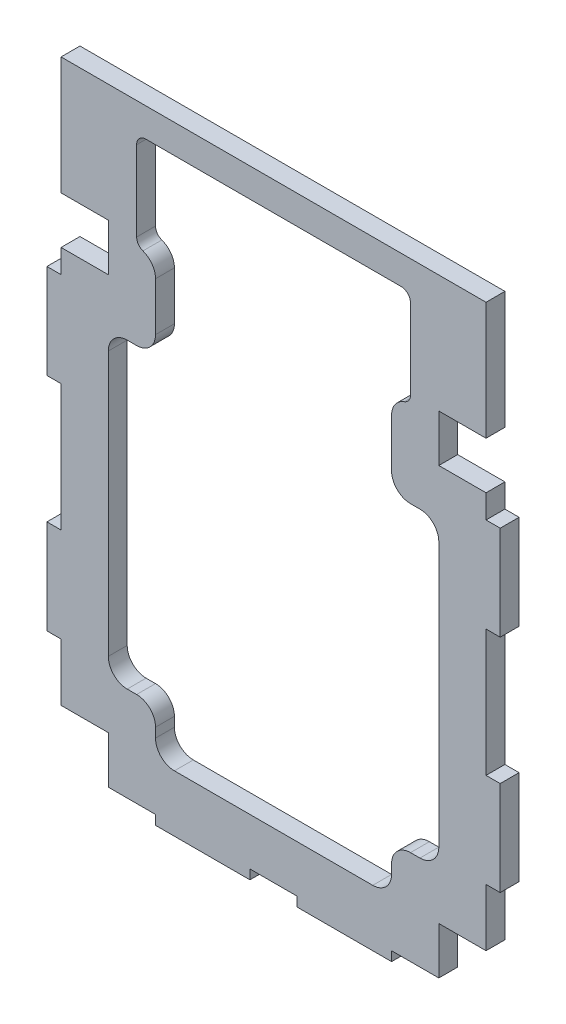
from build123d import *

# Parameters (mm, degrees)
EXTRUDE_1_DEPTH = 2


with BuildPart() as part:
    # Model → 凸台-拉伸1 (new body)
    with BuildSketch(Plane.XY):
        Polygon((1254.914320118, 540.768046392), (1254.914320118, 528.295619897), (1259.914320118, 528.295619897), (1259.914320118, 523.295619897), (1254.914320118, 523.295619897), (1254.914320118, 520.800244347), (1253.414320118, 520.800244347), (1253.414320118, 510.800244347), (1254.914320118, 510.800244347), (1254.914320118, 497.378469897), (1253.414320118, 497.378469897), (1253.414320118, 487.378469897), (1254.914320118, 487.378469897), (1254.914320118, 481.295619897), (1259.914320118, 481.295619897), (1259.914320118, 476.295619897), (1264.914320118, 476.295619897), (1264.914320118, 475.295619897), (1274.914320118, 475.295619897), (1274.914320118, 476.295619897), (1279.914320118, 476.295619897), (1279.914320118, 475.295619897), (1289.914320118, 475.295619897), (1289.914320118, 476.295619897), (1294.914320118, 476.295619897), (1294.914320118, 481.295619897), (1299.914320118, 481.295619897), (1299.914320118, 487.378469897), (1301.414320118, 487.378469897), (1301.414320118, 497.378469897), (1299.914320118, 497.378469897), (1299.914320118, 510.800244347), (1301.414320118, 510.800244347), (1301.414320118, 520.800244347), (1299.914320118, 520.800244347), (1299.914320118, 523.295619897), (1294.914320118, 523.295619897), (1294.914320118, 528.295619897), (1299.914320118, 528.295619897), (1299.914320118, 540.768046392), align=None)
        with BuildLine():
            Line((1264.914320118, 525.425619897), (1264.914320118, 520.295619897))
            ThreePointArc((1264.914320118, 520.295619897), (1264.32853368, 518.881406334), (1262.914320118, 518.295619897))
            Line((1262.914320118, 518.295619897), (1261.914320118, 518.295619897))
            ThreePointArc((1261.914320118, 518.295619897), (1260.500106556, 517.709833459), (1259.914320118, 516.295619897))
            Line((1259.914320118, 516.295619897), (1259.914320118, 488.295619897))
            ThreePointArc((1259.914320118, 488.295619897), (1260.500106556, 486.881406334), (1261.914320118, 486.295619897))
            Line((1261.914320118, 486.295619897), (1262.914320118, 486.295619897))
            ThreePointArc((1262.914320118, 486.295619897), (1264.32853368, 485.709833459), (1264.914320118, 484.295619897))
            Line((1264.914320118, 484.295619897), (1264.914320118, 483.295619897))
            ThreePointArc((1264.914320118, 483.295619897), (1265.500106556, 481.881406334), (1266.914320118, 481.295619897))
            Line((1266.914320118, 481.295619897), (1287.914320118, 481.295619897))
            ThreePointArc((1287.914320118, 481.295619897), (1289.32853368, 481.881406334), (1289.914320118, 483.295619897))
            Line((1289.914320118, 483.295619897), (1289.914320118, 484.295619897))
            ThreePointArc((1289.914320118, 484.295619897), (1290.500106556, 485.709833459), (1291.914320118, 486.295619897))
            Line((1291.914320118, 486.295619897), (1292.914320118, 486.295619897))
            ThreePointArc((1292.914320118, 486.295619897), (1294.32853368, 486.881406334), (1294.914320118, 488.295619897))
            Line((1294.914320118, 488.295619897), (1294.914320118, 516.295619897))
            ThreePointArc((1294.914320118, 516.295619897), (1294.32853368, 517.709833459), (1292.914320118, 518.295619897))
            Line((1292.914320118, 518.295619897), (1291.914320118, 518.295619897))
            ThreePointArc((1291.914320118, 518.295619897), (1290.500106556, 518.881406334), (1289.914320118, 520.295619897))
            Line((1289.914320118, 520.295619897), (1289.914320118, 525.425619897))
            ThreePointArc((1289.914320118, 525.425619897), (1290.281326956, 526.580320435), (1291.247653451, 527.31123798))
            ThreePointArc((1291.247653451, 527.31123798), (1291.730816699, 527.676696752), (1291.914320118, 528.254047021))
            Line((1291.914320118, 528.254047021), (1291.914320118, 536.716299759))
            ThreePointArc((1291.914320118, 536.716299759), (1291.621426899, 537.42340654), (1290.914320118, 537.716299759))
            Line((1290.914320118, 537.716299759), (1263.914320118, 537.716299759))
            ThreePointArc((1263.914320118, 537.716299759), (1263.207213337, 537.42340654), (1262.914320118, 536.716299759))
            Line((1262.914320118, 536.716299759), (1262.914320118, 528.254047021))
            ThreePointArc((1262.914320118, 528.254047021), (1263.097823537, 527.676696752), (1263.580986785, 527.31123798))
            ThreePointArc((1263.580986785, 527.31123798), (1264.54731328, 526.580320435), (1264.914320118, 525.425619897))
        make_face(mode=Mode.SUBTRACT)
    extrude(amount=EXTRUDE_1_DEPTH)


solid = part.part
